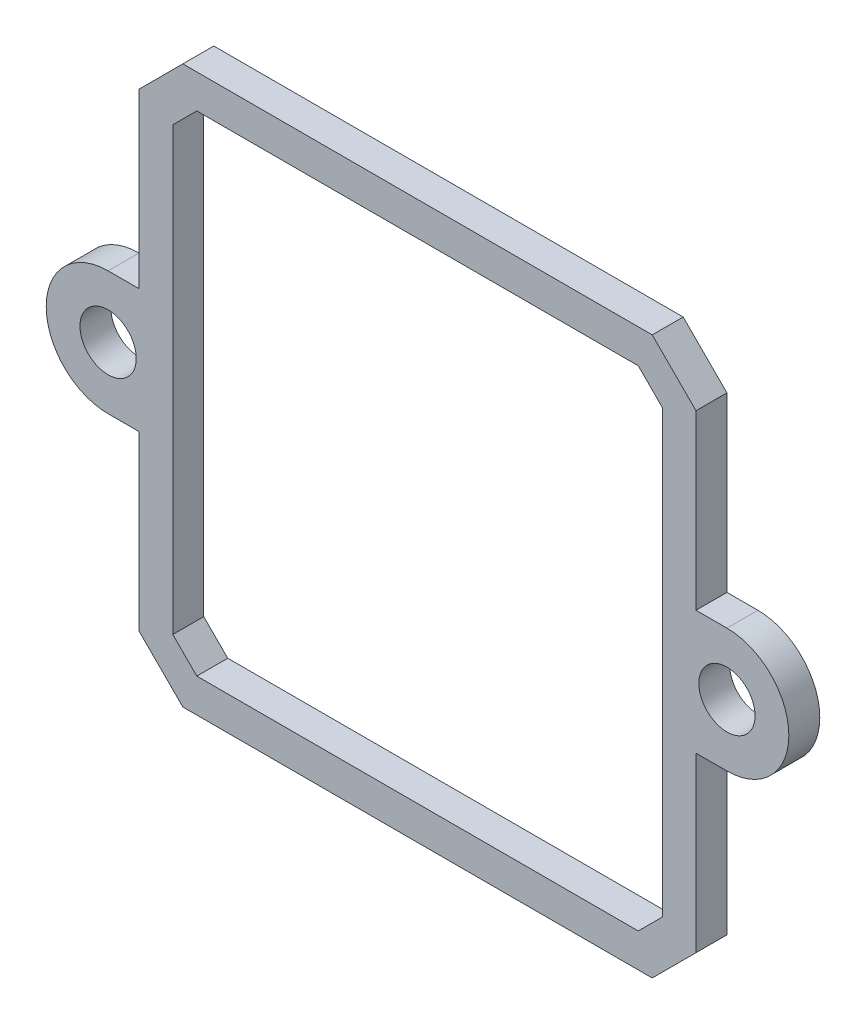
from build123d import *

# Parameters (mm, degrees)
SKETCH1_R           = 1
BOSS_EXTRUDE1_DEPTH = 1.1


with BuildPart() as part:
    # Sketch1 → Boss-Extrude1 (new body)
    # profile 1 of 3: a face of its own
    with BuildSketch(Plane.XY):
        Polygon((-8.343354955, 9.9), (-9.9, 8.343354955), (-9.9, 2.2), (-9.9, -2.2), (-9.9, -8.343354955), (-8.343354955, -9.9), (8.343354955, -9.9), (9.9, -8.343354955), (9.9, -2.2), (9.9, 2.2), (9.9, 8.343354955), (8.343354955, 9.9), align=None)
        Polygon((-8.7, -7.84629868), (-8.7, 7.84629868), (-7.84629868, 8.7), (7.84629868, 8.7), (8.7, 7.84629868), (8.7, -7.84629868), (7.84629868, -8.7), (-7.84629868, -8.7), align=None, mode=Mode.SUBTRACT)
    # profile 2 of 3: a face of its own
    with BuildSketch(Plane.XY):
        with BuildLine():
            Line((-9.9, -2.2), (-9.9, 2.2))
            Line((-9.9, 2.2), (-11.000000224, 2.2))
            ThreePointArc((-11.000000224, 2.2), (-13.200000224, 0), (-11.000000224, -2.2))
            Line((-11.000000224, -2.2), (-9.9, -2.2))
        make_face()
        with Locations((-11.000000224, 0)):
            Circle(SKETCH1_R, mode=Mode.SUBTRACT)
    # profile 3 of 3: a face of its own
    with BuildSketch(Plane.XY):
        with BuildLine():
            Line((11, 2.2), (9.9, 2.2))
            Line((9.9, 2.2), (9.9, -2.2))
            Line((9.9, -2.2), (11, -2.2))
            ThreePointArc((11, -2.2), (13.2, 0), (11, 2.2))
        make_face()
        with Locations((11, 0)):
            Circle(SKETCH1_R, mode=Mode.SUBTRACT)
    extrude(amount=BOSS_EXTRUDE1_DEPTH)


solid = part.part
